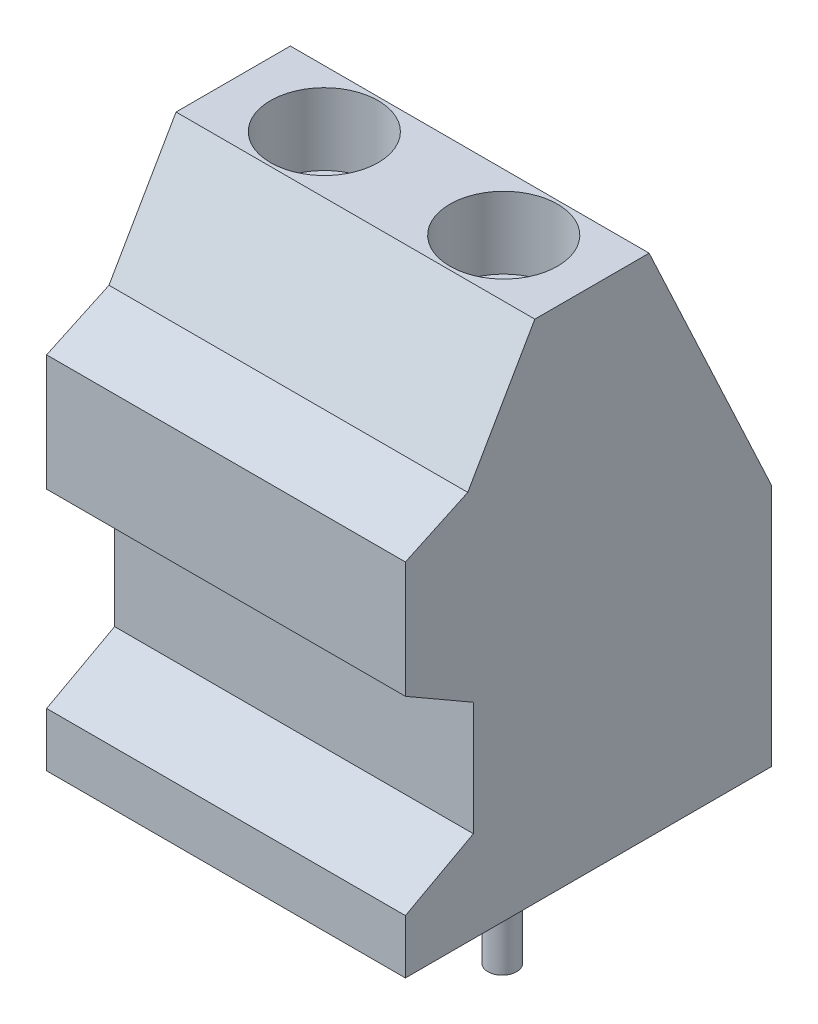
from build123d import *

# Parameters (mm, degrees)
EXTRUDE_1_DEPTH     = 10
SKETCH_2_R          = 1.5
CUT_EXTRUDE_1_DEPTH = 2
SKETCH_3_R          = 0.4
EXTRUDE_2_DEPTH     = 3.5


with BuildPart() as part:
    # 草图1 → 凸台-拉伸1 (new body)
    with BuildSketch(Plane(origin=(0, 0, 0), x_dir=(0, 0, -1), z_dir=(1, 0, 0))):
        Polygon((0, 0), (5, 0), (5, 6.798949449), (1.592861235, 14.1), (-1.592861235, 14.1), (-3.462246636, 10.852770352), (-5.2, 10.041823104), (-5.2, 6.798949449), (-3.305827132, 5.708500208), (-3.305827132, 2.534594125), (-5.2, 1.506142854), (-5.2, 0), align=None)
    extrude(amount=EXTRUDE_1_DEPTH)

    # 草图2 → 切除-拉伸1 (cut)
    with BuildSketch(Plane(origin=(0, 14.1, 0), x_dir=(1, 0, 0), z_dir=(0, 1, 0))):
        with Locations(Location((2.54, 0, 0), (0, 0, 270))):
            Circle(SKETCH_2_R)
        with Locations(Location((7.54, 0, 0), (0, 0, 270))):
            Circle(SKETCH_2_R)
    extrude(amount=-CUT_EXTRUDE_1_DEPTH, mode=Mode.SUBTRACT)

    # 草图3 → 凸台-拉伸2 (add)
    with BuildSketch(Plane.XZ):
        with Locations(Location((2.5, 0, 0), (0, 0, 90))):
            Circle(SKETCH_3_R)
        with Locations(Location((7.5, 0, 0), (0, 0, 90))):
            Circle(SKETCH_3_R)
    extrude(amount=EXTRUDE_2_DEPTH)


solid = part.part
